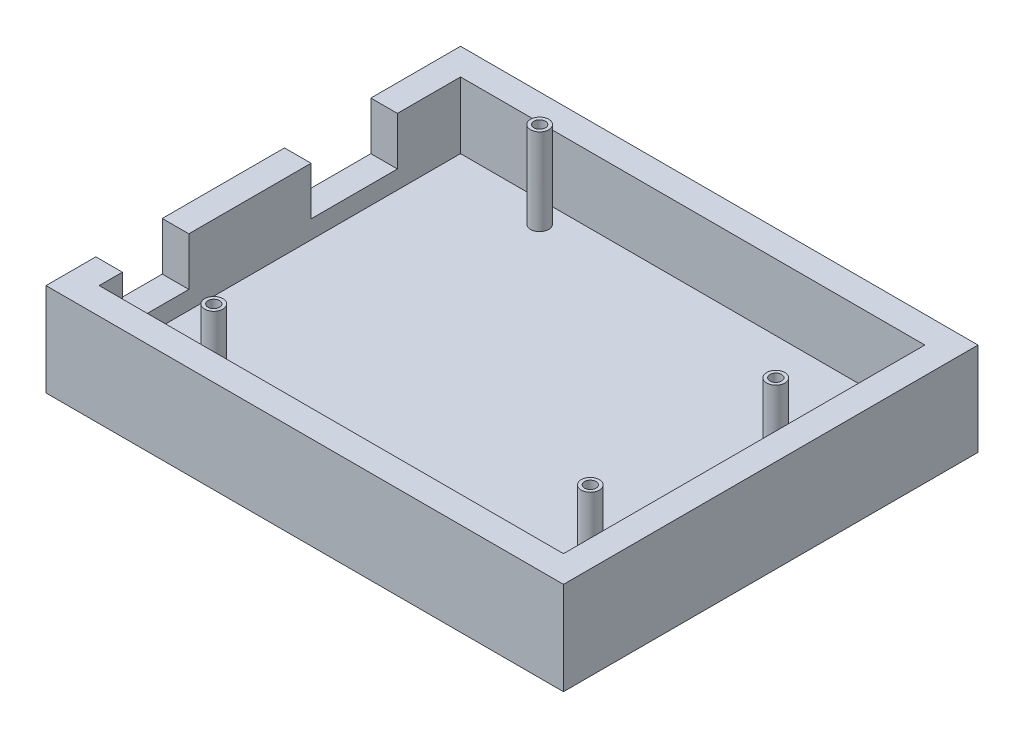
from build123d import *

# Parameters (mm, degrees)
SKETCH1_W           = 77.9
SKETCH1_H           = 62.4
SKETCH1_W_2         = 69.9
SKETCH1_H_2         = 54.4
BOSS_EXTRUDE1_DEPTH = 10
SKETCH2_W           = 77.9
SKETCH2_H           = 62.4
BOSS_EXTRUDE2_DEPTH = 4
CUT_EXTRUDE1_REACH  = 99.872
SKETCH3_W           = 13
SKETCH3_H           = 7.25
CUT_EXTRUDE2_REACH  = 99.872
SKETCH4_W           = 10
SKETCH4_H           = 7.25
SKETCH5_R           = 1.36925
BOSS_EXTRUDE3_DEPTH = 17
SKETCH6_R           = 0.86925
CUT_EXTRUDE3_DEPTH  = 10


with BuildPart() as part:
    # Sketch1 → Boss-Extrude1 (new body)
    with BuildSketch(Plane(origin=(0, 0, 0), x_dir=(1, 0, 0), z_dir=(0, 1, 0))):
        with Locations((34.95, 27.2)):
            Rectangle(SKETCH1_W, SKETCH1_H)
        with Locations((34.95, 27.2)):
            Rectangle(SKETCH1_W_2, SKETCH1_H_2, mode=Mode.SUBTRACT)
    extrude(amount=BOSS_EXTRUDE1_DEPTH)

    # Sketch2 → Boss-Extrude2 (add)
    with BuildSketch(Plane(origin=(0, 0, 0), x_dir=(1, 0, 0), z_dir=(0, 1, 0))):
        with Locations((34.95, 27.2)):
            Rectangle(SKETCH2_W, SKETCH2_H)
    extrude(amount=-BOSS_EXTRUDE2_DEPTH)

    # Sketch3 → Cut-Extrude1 (cut, up to next)
    with BuildSketch(Plane.ZY.offset(4), mode=Mode.PRIVATE) as cut_extrude1_sk1:
        with Locations((-38.4, 6.375)):
            Rectangle(SKETCH3_W, SKETCH3_H)
    cut_extrude1_tool1 = extrude(cut_extrude1_sk1.sketch, amount=-CUT_EXTRUDE1_REACH, mode=Mode.PRIVATE) & part.part
    add(cut_extrude1_tool1.solids().sort_by_distance((-4, 6.375, -38.4))[0], mode=Mode.SUBTRACT)

    # Sketch4 → Cut-Extrude2 (cut, up to next)
    with BuildSketch(Plane.ZY.offset(4), mode=Mode.PRIVATE) as cut_extrude2_sk1:
        with Locations((-8.5, 6.375)):
            Rectangle(SKETCH4_W, SKETCH4_H)
    cut_extrude2_tool1 = extrude(cut_extrude2_sk1.sketch, amount=-CUT_EXTRUDE2_REACH, mode=Mode.PRIVATE) & part.part
    add(cut_extrude2_tool1.solids().sort_by_distance((-4, 6.375, -8.5))[0], mode=Mode.SUBTRACT)

    # Sketch5 → Boss-Extrude3 (add)
    with BuildSketch(Plane(origin=(0, -4, 0), x_dir=(-1, 0, 0), z_dir=(0, -1, 0))):
        with Locations((-65.94475, 7.99125)):
            Circle(SKETCH5_R)
        with Locations((-15.15745, 51.15855)):
            Circle(SKETCH5_R)
        with Locations((-65.94475, 35.91855)):
            Circle(SKETCH5_R)
        with Locations((-14.01445, 3.24145)):
            Circle(SKETCH5_R)
    extrude(amount=-BOSS_EXTRUDE3_DEPTH)

    # Sketch6 → Cut-Extrude3 (cut)
    with BuildSketch(Plane(origin=(0, 13, 0), x_dir=(1, 0, 0), z_dir=(0, 1, 0))):
        with Locations((65.94475, 35.91855)):
            Circle(SKETCH6_R)
        with Locations((65.94475, 7.99125)):
            Circle(SKETCH6_R)
        with Locations((14.01445, 3.24145)):
            Circle(SKETCH6_R)
        with Locations((15.15745, 51.15855)):
            Circle(SKETCH6_R)
    extrude(amount=-CUT_EXTRUDE3_DEPTH, mode=Mode.SUBTRACT)


solid = part.part
